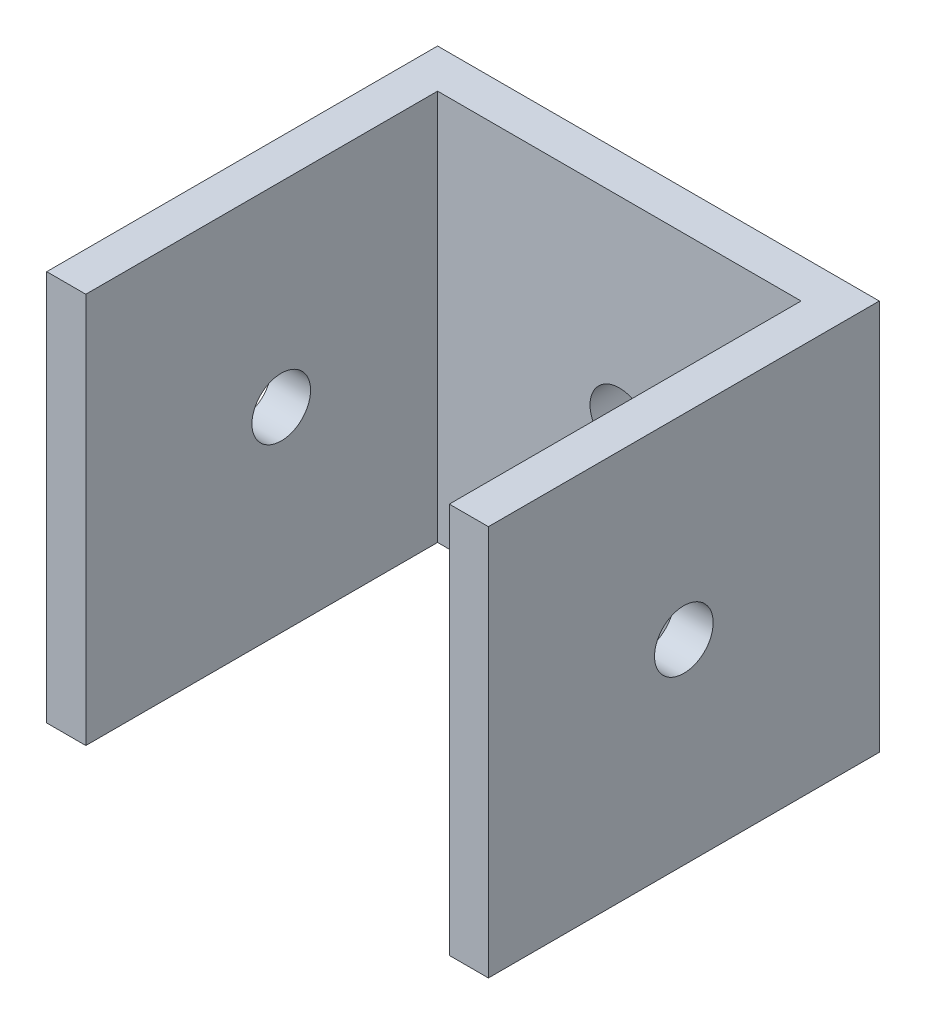
from build123d import *

# Parameters (mm, degrees)
BOSS_EXTRUDE1_DEPTH = 100
SKETCH2_R           = 7.5
CUT_EXTRUDE1_DEPTH  = 140
SKETCH3_R           = 7.5
CUT_EXTRUDE2_DEPTH  = 140


with BuildPart() as part:
    # Sketch1 → Boss-Extrude1 (new body)
    with BuildSketch(Plane(origin=(0, 0, 0), x_dir=(1, 0, 0), z_dir=(0, 1, 0))):
        Polygon((-56.5, 0), (56.5, 0), (56.5, -100), (46.5, -100), (46.5, -10), (-46.5, -10), (-46.5, -100), (-56.5, -100), align=None)
    extrude(amount=BOSS_EXTRUDE1_DEPTH)

    # Sketch2 → Cut-Extrude1 (cut)
    with BuildSketch(Plane(origin=(56.5, 0, 0), x_dir=(0, 0, -1), z_dir=(1, 0, 0))):
        with Locations((-50, 50)):
            Circle(SKETCH2_R)
    extrude(amount=-CUT_EXTRUDE1_DEPTH, mode=Mode.SUBTRACT)

    # Sketch3 → Cut-Extrude2 (cut)
    with BuildSketch(Plane(origin=(0, 0, 0), x_dir=(-1, 0, 0), z_dir=(0, 0, -1))):
        with Locations((0, 50)):
            Circle(SKETCH3_R)
    extrude(amount=-CUT_EXTRUDE2_DEPTH, mode=Mode.SUBTRACT)


solid = part.part
